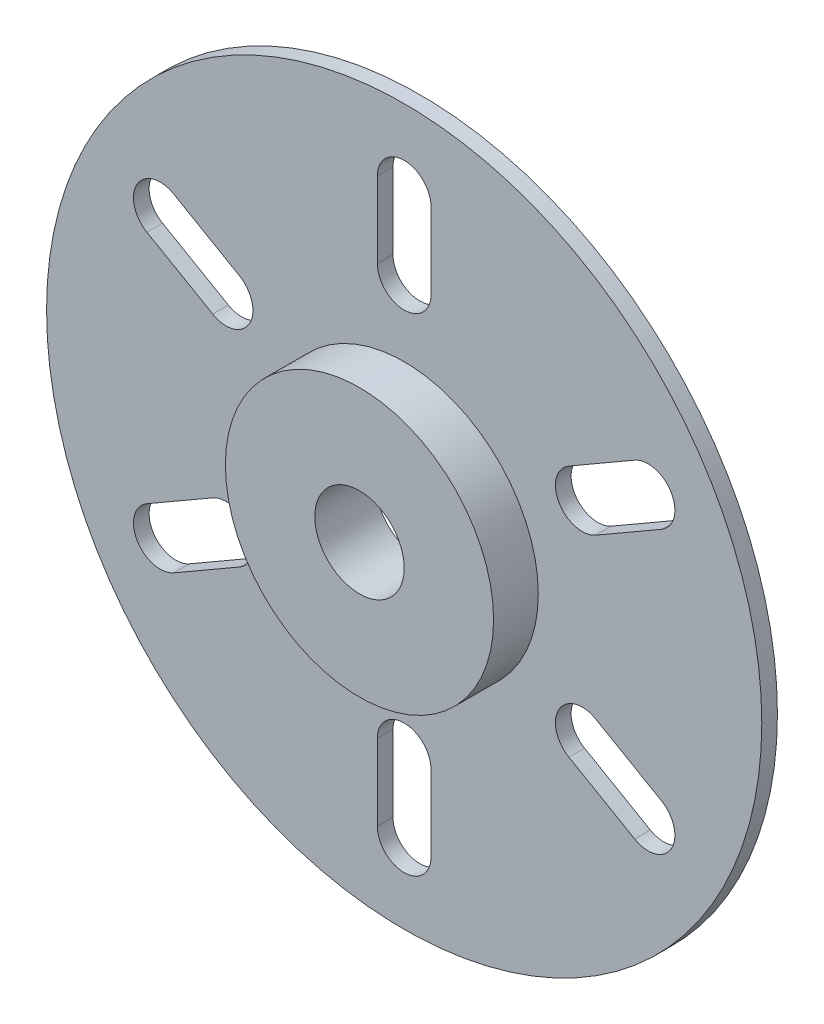
from build123d import *

# Parameters (mm, degrees)
SKETCH1_R           = 80
BOSS_EXTRUDE1_DEPTH = 3.5
SKETCH2_R           = 10
CUT_EXTRUDE1_DEPTH  = 3.5
BOSS_EXTRUDE2_START = 10
SKETCH3_R           = 30
SKETCH3_R_2         = 10
BOSS_EXTRUDE2_DEPTH = 10
CUT_EXTRUDE2_DEPTH  = 3.5


with BuildPart() as part:
    # Sketch1 → Boss-Extrude1 (new body)
    with BuildSketch(Plane.XY):
        Circle(SKETCH1_R)
    extrude(amount=BOSS_EXTRUDE1_DEPTH)

    # Sketch2 → Cut-Extrude1 (cut)
    with BuildSketch(Plane.XY.offset(3.5)):
        Circle(SKETCH2_R)
    extrude(amount=-CUT_EXTRUDE1_DEPTH, mode=Mode.SUBTRACT)

    # Sketch3 → Boss-Extrude2 (add)
    with BuildSketch(Plane.XY.offset(3.5).offset(BOSS_EXTRUDE2_START)):
        Circle(SKETCH3_R)
        Circle(SKETCH3_R_2, mode=Mode.SUBTRACT)
    extrude(amount=-BOSS_EXTRUDE2_DEPTH)

    # Sketch6 → Cut-Extrude2 (cut)
    with BuildSketch(Plane.XY.offset(3.5)):
        with BuildLine():
            Line((36.837168574, 28.196152423), (51.559600438, 36.696152423))
            ThreePointArc((51.559600438, 36.696152423), (59.755752861, 34.5), (57.559600438, 26.303847577))
            Line((57.559600438, 26.303847577), (42.837168574, 17.803847577))
            ThreePointArc((42.837168574, 17.803847577), (34.641016151, 20), (36.837168574, 28.196152423))
        make_face()
        with BuildLine():
            Line((42.837168574, -17.803847577), (57.559600438, -26.303847577))
            ThreePointArc((57.559600438, -26.303847577), (59.755752861, -34.5), (51.559600438, -36.696152423))
            Line((51.559600438, -36.696152423), (36.837168574, -28.196152423))
            ThreePointArc((36.837168574, -28.196152423), (34.641016151, -20), (42.837168574, -17.803847577))
        make_face()
        with BuildLine():
            Line((6, -46), (6, -63))
            ThreePointArc((6, -63), (0, -69), (-6, -63))
            Line((-6, -63), (-6, -46))
            ThreePointArc((-6, -46), (0, -40), (6, -46))
        make_face()
        with BuildLine():
            Line((-36.837168574, -28.196152423), (-51.559600438, -36.696152423))
            ThreePointArc((-51.559600438, -36.696152423), (-59.755752861, -34.5), (-57.559600438, -26.303847577))
            Line((-57.559600438, -26.303847577), (-42.837168574, -17.803847577))
            ThreePointArc((-42.837168574, -17.803847577), (-34.641016151, -20), (-36.837168574, -28.196152423))
        make_face()
        with BuildLine():
            Line((-42.837168574, 17.803847577), (-57.559600438, 26.303847577))
            ThreePointArc((-57.559600438, 26.303847577), (-59.755752861, 34.5), (-51.559600438, 36.696152423))
            Line((-51.559600438, 36.696152423), (-36.837168574, 28.196152423))
            ThreePointArc((-36.837168574, 28.196152423), (-34.641016151, 20), (-42.837168574, 17.803847577))
        make_face()
        with BuildLine():
            Line((-6, 46), (-6, 63))
            ThreePointArc((-6, 63), (0, 69), (6, 63))
            Line((6, 63), (6, 46))
            ThreePointArc((6, 46), (0, 40), (-6, 46))
        make_face()
    extrude(amount=-CUT_EXTRUDE2_DEPTH, mode=Mode.SUBTRACT)


solid = part.part
